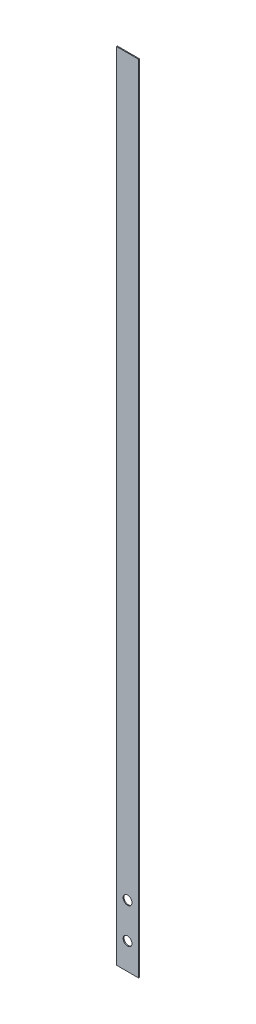
from build123d import *

# Parameters (mm, degrees)
SKETCH1_W           = 5
SKETCH1_H           = 0.2
BOSS_EXTRUDE1_DEPTH = 180
SKETCH2_R           = 1
CUT_EXTRUDE1_DEPTH  = 181.017471374


with BuildPart() as part:
    # Sketch1 → Boss-Extrude1 (new body)
    with BuildSketch(Plane(origin=(0, 0, 0), x_dir=(1, 0, 0), z_dir=(0, 1, 0))):
        Rectangle(SKETCH1_W, SKETCH1_H)
    extrude(amount=BOSS_EXTRUDE1_DEPTH)

    # Sketch2 → Cut-Extrude1 (cut, through all)
    with BuildSketch(Plane(origin=(0, 0, -0.1), x_dir=(-1, 0, 0), z_dir=(0, 0, -1))):
        with Locations((0, 6)):
            Circle(SKETCH2_R)
        with Locations((0, 14)):
            Circle(SKETCH2_R)
    extrude(amount=-CUT_EXTRUDE1_DEPTH, mode=Mode.SUBTRACT)


solid = part.part
